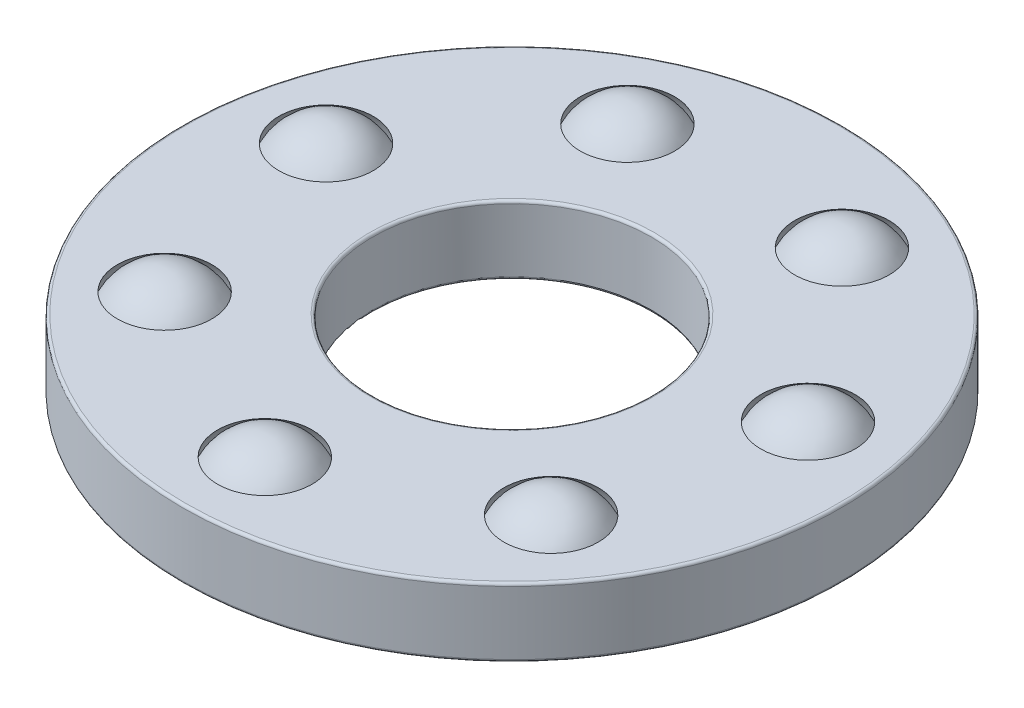
from build123d import *

# Parameters (mm, degrees)
SKETCH1_W         = 3.462
SKETCH1_H         = 1.25
CIRPATTERN1_COUNT = 7
CIRPATTERN1_ANGLE = 308.571428571
CIRPATTERN2_COUNT = 7
SKETCH4_W         = 3.462
SKETCH4_H         = 1.46
FILLET1_R         = 0.0492
FILLET2_R         = 0.0492
FILLET3_R         = 0.0492


with BuildPart() as part:
    # Sketch1 → Revolve1 (revolve)
    with BuildSketch(Plane(origin=(0, 0, 0), x_dir=(0, 0, -1), z_dir=(1, 0, 0)), mode=Mode.PRIVATE) as revolve1_sk:
        with Locations((-4.269, 0)):
            Rectangle(SKETCH1_W, SKETCH1_H)
    revolve(revolve1_sk.sketch.rotate(Axis((0, -2.46, 0), (0, 1, 0)), 180), axis=Axis((0, -2.46, 0), (0, 1, 0)))

    # Sketch3 → Cut-Revolve1 (revolve, cut)
    with BuildSketch(Plane(origin=(0, 0, 0), x_dir=(0, 0, -1), z_dir=(1, 0, 0))):
        with BuildLine():
            Line((-4.5, 1.0625), (-4.5, -1.0625))
            ThreePointArc((-4.5, -1.0625), (-5.5625, 0), (-4.5, 1.0625))
        make_face()
    cut_revolve1 = revolve(axis=Axis((0, 1.0625, 4.5), (0, -1, 0)), mode=Mode.SUBTRACT)

    # CirPattern2: Cut-Revolve1 ×7 about axis
    cirpattern2_axis = Axis((0, 0, 0), (0, 1, 0))
    for i in range(1, CIRPATTERN2_COUNT):
        add(cut_revolve1.rotate(cirpattern2_axis, i * 360 / CIRPATTERN2_COUNT), mode=Mode.SUBTRACT)

    # Fillet2
    fillet2_edges = [part.edges().sort_by_distance(p)[0] for p in [
        (0, 0.625, 6),
        (0, 0.625, 2.538),
        (0, -0.625, 2.538),
        (0, -0.625, 6),
    ]]
    fillet(fillet2_edges, radius=FILLET2_R)


with BuildPart() as body_2:
    # Sketch2 → Revolve2 (revolve)
    with BuildSketch(Plane(origin=(0, 0, 0), x_dir=(0, 0, -1), z_dir=(1, 0, 0))):
        with BuildLine():
            Line((-4.5, 1), (-4.5, -1))
            ThreePointArc((-4.5, -1), (-5.5, 0), (-4.5, 1))
        make_face()
    revolve(axis=Axis((0, 1, 4.5), (0, -1, 0)))


with BuildPart() as cirpattern1_1:
    # CirPattern1: pattern copy
    add(body_2.part.rotate(Axis((0, 2.46, 0), (0, -1, 0)), 1 * CIRPATTERN1_ANGLE / (CIRPATTERN1_COUNT - 1)))


with BuildPart() as cirpattern1_2:
    # CirPattern1: pattern copy
    add(body_2.part.rotate(Axis((0, 2.46, 0), (0, -1, 0)), 2 * CIRPATTERN1_ANGLE / (CIRPATTERN1_COUNT - 1)))


with BuildPart() as cirpattern1_3:
    # CirPattern1: pattern copy
    add(body_2.part.rotate(Axis((0, 2.46, 0), (0, -1, 0)), 3 * CIRPATTERN1_ANGLE / (CIRPATTERN1_COUNT - 1)))


with BuildPart() as cirpattern1_4:
    # CirPattern1: pattern copy
    add(body_2.part.rotate(Axis((0, 2.46, 0), (0, -1, 0)), 4 * CIRPATTERN1_ANGLE / (CIRPATTERN1_COUNT - 1)))


with BuildPart() as cirpattern1_5:
    # CirPattern1: pattern copy
    add(body_2.part.rotate(Axis((0, 2.46, 0), (0, -1, 0)), 5 * CIRPATTERN1_ANGLE / (CIRPATTERN1_COUNT - 1)))


with BuildPart() as cirpattern1_6:
    # CirPattern1: pattern copy
    add(body_2.part.rotate(Axis((0, 2.46, 0), (0, -1, 0)), 6 * CIRPATTERN1_ANGLE / (CIRPATTERN1_COUNT - 1)))


with BuildPart() as body_9:
    # Sketch4 → Revolve3 (revolve)
    with BuildSketch(Plane(origin=(0, 0, 0), x_dir=(0, 0, -1), z_dir=(1, 0, 0)), mode=Mode.PRIVATE) as revolve3_sk:
        with Locations((-4.269, 1.73)):
            Rectangle(SKETCH4_W, SKETCH4_H)
        with Locations((-4.269, -1.73)):
            Rectangle(SKETCH4_W, SKETCH4_H)
    revolve(revolve3_sk.sketch.rotate(Axis((0, -2.46, 0), (0, 1, 0)), 180), axis=Axis((0, -2.46, 0), (0, 1, 0)))

    # Fillet1
    fillet1_edges = [body_9.edges().sort_by_distance(p)[0] for p in [
        (0, 1, 6),
        (0, 1, 2.538),
        (0, 2.46, 2.538),
        (0, 2.46, 6),
    ]]
    fillet(fillet1_edges, radius=FILLET1_R)

    # Fillet3
    fillet3_edges = [body_9.edges().sort_by_distance(p)[0] for p in [
        (0, -2.46, 6),
        (0, -2.46, 2.538),
        (0, -1, 2.538),
        (0, -1, 6),
    ]]
    fillet(fillet3_edges, radius=FILLET3_R)


solid = Compound([part.part, body_2.part, cirpattern1_1.part, cirpattern1_2.part, cirpattern1_3.part, cirpattern1_4.part, cirpattern1_5.part, cirpattern1_6.part])
